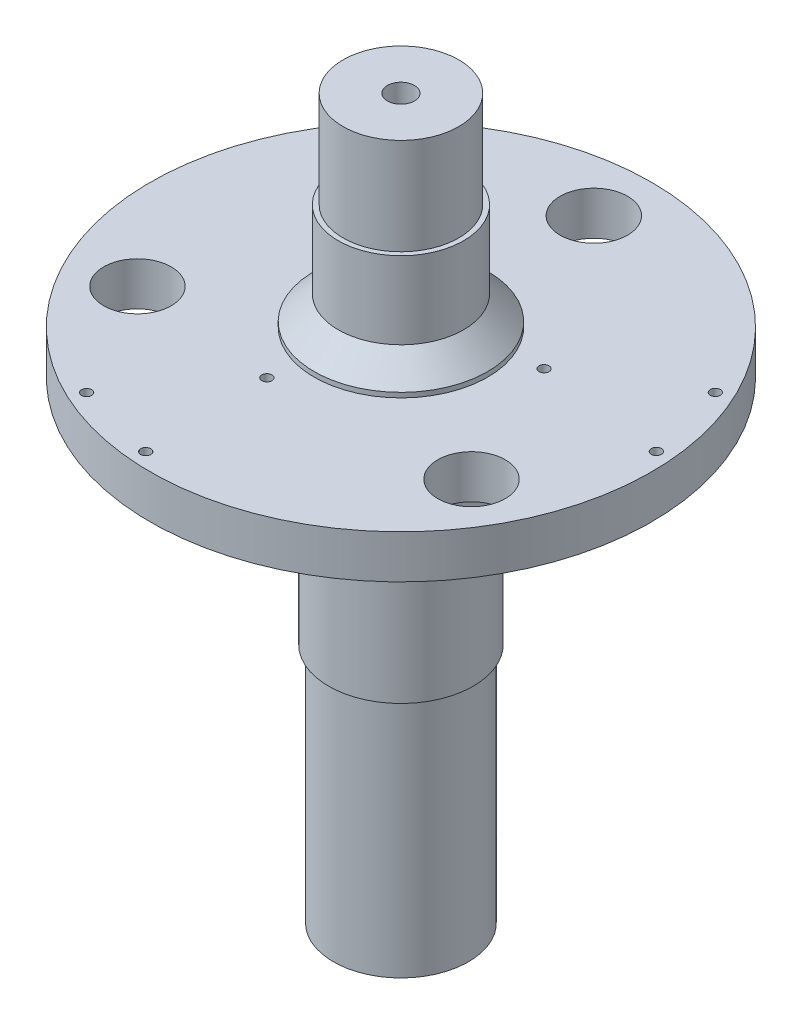
from build123d import *

# Parameters (mm, degrees)
M30X2_0_1_D              = 28
M30X2_0_1_DEPTH          = 60
M30X2_0_1_TIP            = 8.412048666
CUT_EXTRUDE_1_REACH      = 651.173
SKETCH_4_R               = 35
PATTERN_CIRCULAR_1_COUNT = 3
SKETCH_5_R               = 5.25
CUT_EXTRUDE_2_DEPTH      = 30
PATTERN_CIRCULAR_2_COUNT = 3


with BuildPart() as part:
    # 草图1 → 旋转1 (revolve)
    with BuildSketch(Plane.XY, mode=Mode.PRIVATE) as revolve_1_sk:
        Polygon((0, 0), (-60, 0), (-60, -100), (-65, -100), (-65, -180), (-90, -205), (-90, -210), (-260, -210), (-260, -255), (-75, -255), (-75, -495), (-70, -495), (-70, -745), (0, -745), align=None)
    revolve(revolve_1_sk.sketch.rotate(Axis((0, -745, 0), (0, 1, 0)), 270), axis=Axis((0, -745, 0), (0, 1, 0)))

    # M30x2.0 螺纹孔1
    with Locations(Plane(origin=(0, 0, 0), x_dir=(1, 0, 0), z_dir=(0, 1, 0))):
        with Locations((0, 0)):
            Hole(M30X2_0_1_D / 2, depth=M30X2_0_1_DEPTH)
            with Locations((0, 0, -(M30X2_0_1_DEPTH + M30X2_0_1_TIP / 2))):  # 118° drill point
                Cone(0, M30X2_0_1_D / 2, M30X2_0_1_TIP, mode=Mode.SUBTRACT)

    # 草图4 → 切除-拉伸1 (cut, up to next)
    with BuildSketch(Plane(origin=(0, -210, 0), x_dir=(1, 0, 0), z_dir=(0, 1, 0)), mode=Mode.PRIVATE) as cut_extrude_1_sk1:
        with Locations(Location((-173.205080757, -100, 0), (0, 0, 270))):
            Circle(SKETCH_4_R)
    cut_extrude_1_tool1 = extrude(cut_extrude_1_sk1.sketch, amount=-CUT_EXTRUDE_1_REACH, mode=Mode.PRIVATE) & part.part
    cut_extrude_1 = cut_extrude_1_tool1.solids().sort_by_distance((-173.205081, -210, 100))[0]
    add(cut_extrude_1, mode=Mode.SUBTRACT)

    # 阵列(圆周)1: 切除-拉伸1 ×3 about axis
    pattern_circular_1_axis = Axis((0, 0, 0), (0, 1, 0))
    for i in range(1, PATTERN_CIRCULAR_1_COUNT):
        add(cut_extrude_1.rotate(pattern_circular_1_axis, i * 360 / PATTERN_CIRCULAR_1_COUNT), mode=Mode.SUBTRACT)

    # 草图5 → 切除-拉伸2 (cut)
    with BuildSketch(Plane(origin=(0, -210, 0), x_dir=(1, 0, 0), z_dir=(0, 1, 0))):
        with Locations(Location((-23.960098386, -115.031142241, 0), (0, 0, 270))):
            Circle(SKETCH_5_R)
        with Locations(Location((-104.106501212, -221.781055109, 0), (0, 0, 270))):
            Circle(SKETCH_5_R)
        with Locations(Location((-20.464389875, -244.143827993, 0), (0, 0, 270))):
            Circle(SKETCH_5_R)
    cut_extrude_2 = extrude(amount=-CUT_EXTRUDE_2_DEPTH, mode=Mode.SUBTRACT)

    # 阵列(圆周)2: 切除-拉伸2 ×3 about axis
    pattern_circular_2_axis = Axis((0, 0, 0), (0, 1, 0))
    for i in range(1, PATTERN_CIRCULAR_2_COUNT):
        add(cut_extrude_2.rotate(pattern_circular_2_axis, i * 360 / PATTERN_CIRCULAR_2_COUNT), mode=Mode.SUBTRACT)


solid = part.part
